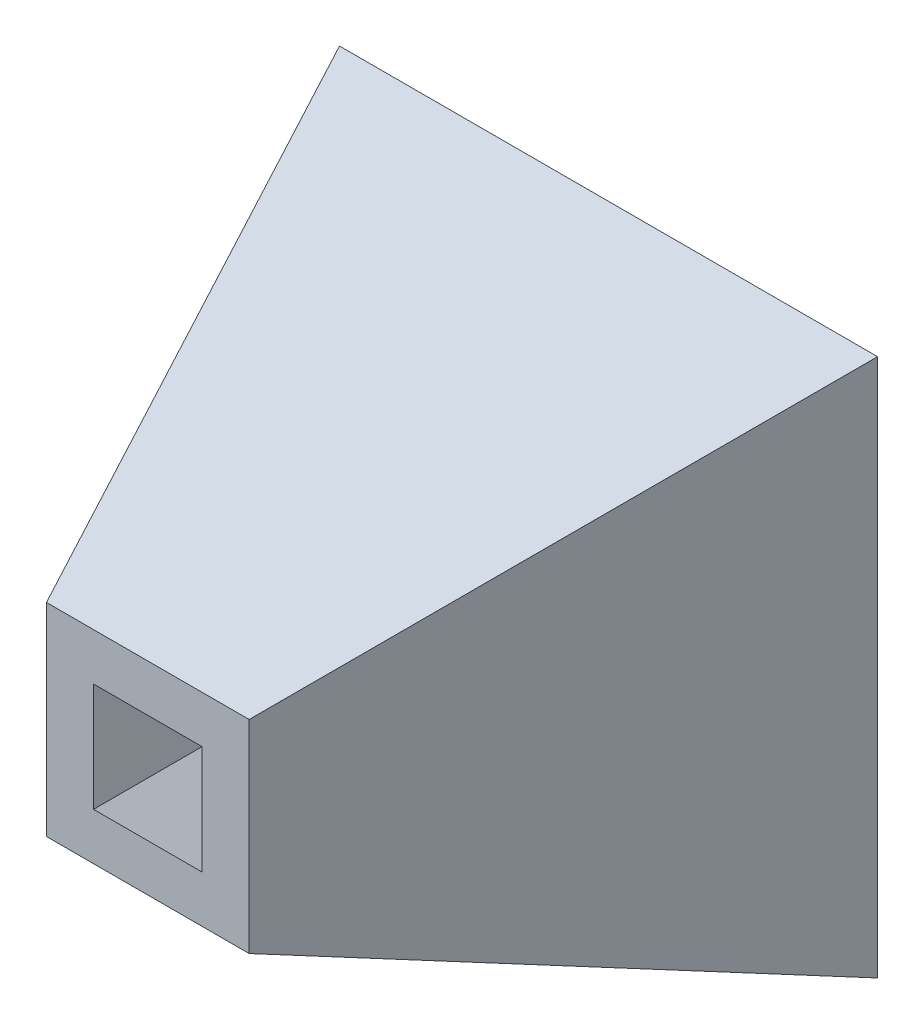
from build123d import *

# Parameters (mm, degrees)
SKETCH7_W           = 22
SKETCH7_H           = 22
BOSS_EXTRUDE2_DEPTH = 50
DRAFT2_ANGLE        = 20
SHELL2_T            = -4.8


with BuildPart() as part:
    # Sketch7 → Boss-Extrude2 (new body)
    with BuildSketch(Plane.XY):
        with Locations((11, 11)):
            Rectangle(SKETCH7_W, SKETCH7_H)
    extrude(amount=BOSS_EXTRUDE2_DEPTH)

    # Draft2
    draft2_faces = [part.faces().sort_by_distance(p)[0] for p in [
        (22, 11, 25),
        (11, 0, 25),
        (0, 11, 25),
        (11, 22, 25),
    ]]
    draft(draft2_faces, Plane.XY.offset(50), DRAFT2_ANGLE)

    # Shell2
    shell2_openings = [part.faces().sort_by_distance(p)[0] for p in [
        (11, 11, 50),
        (11, 11, 0),
    ]]
    offset(amount=SHELL2_T, openings=shell2_openings, kind=Kind.INTERSECTION)


solid = part.part
